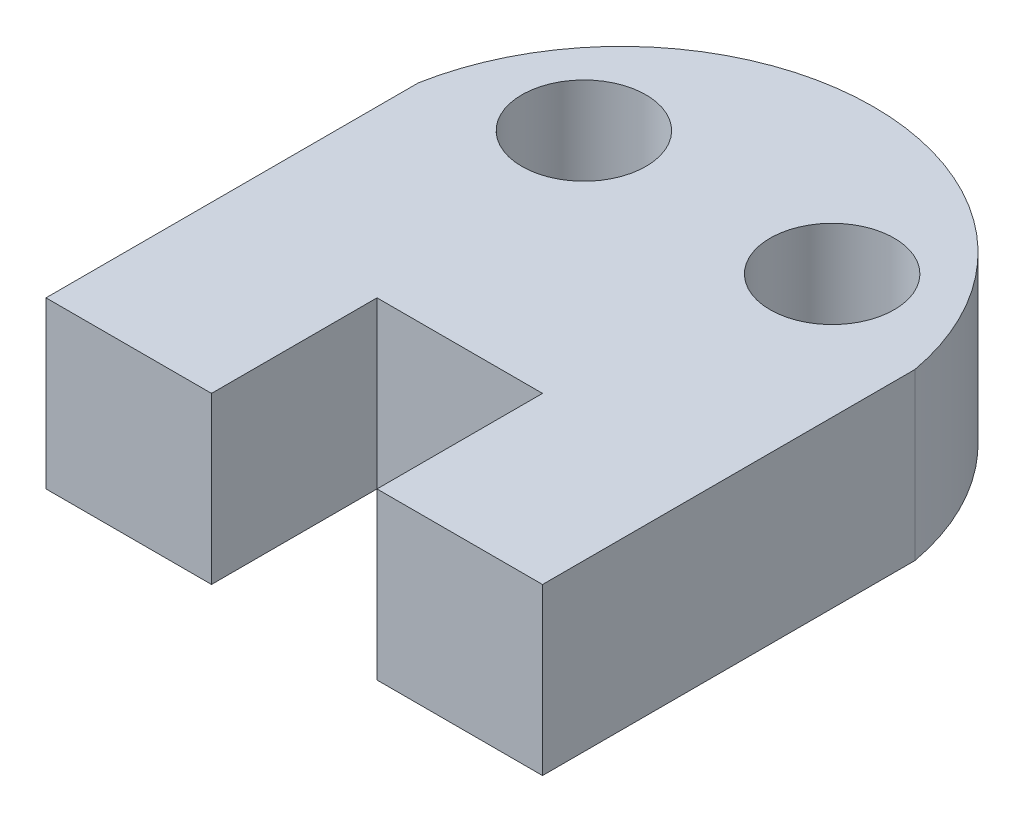
from build123d import *

# Parameters (mm, degrees)
SKETCH1_W           = 12
SKETCH1_H           = 10
SKETCH1_W_2         = 4
SKETCH1_H_2         = 4
BOSS_EXTRUDE1_DEPTH = 4
SKETCH2_R           = 1.5
CUT_EXTRUDE1_DEPTH  = 12.532562595
CUT_EXTRUDE3_DEPTH  = 4


with BuildPart() as part:
    # Sketch1 → Boss-Extrude1 (new body)
    with BuildSketch(Plane(origin=(0, 0, 0), x_dir=(1, 0, 0), z_dir=(0, 1, 0))):
        Rectangle(SKETCH1_W, SKETCH1_H)
        with Locations((-4, -7)):
            Rectangle(SKETCH1_W_2, SKETCH1_H_2)
        with Locations((4, -7)):
            Rectangle(SKETCH1_W_2, SKETCH1_H_2)
    extrude(amount=BOSS_EXTRUDE1_DEPTH)

    # Sketch2 → Cut-Extrude1 (cut, through all)
    with BuildSketch(Plane(origin=(0, 4, 0), x_dir=(1, 0, 0), z_dir=(0, 1, 0))):
        with Locations(Location((-3, 1, 0), (0, 0, 270))):
            Circle(SKETCH2_R)
        with Locations(Location((3, 1, 0), (0, 0, 270))):
            Circle(SKETCH2_R)
    extrude(amount=-CUT_EXTRUDE1_DEPTH, mode=Mode.SUBTRACT)

    # Sketch3 → Cut-Extrude3 (cut)
    with BuildSketch(Plane(origin=(0, 4, 0), x_dir=(1, 0, 0), z_dir=(0, 1, 0))):
        with BuildLine():
            ThreePointArc((-6, 0), (-3.905124845, 3.586149799), (-1.9e-08, 5))
            Line((-1.9e-08, 5), (-6, 5))
            Line((-6, 5), (-6, 0))
        make_face()
        with BuildLine():
            ThreePointArc((-1.9e-08, 5), (3.905124831, 3.586149812), (6, 0))
            Line((6, 0), (6, 5))
            Line((6, 5), (-1.9e-08, 5))
        make_face()
    extrude(amount=-CUT_EXTRUDE3_DEPTH, mode=Mode.SUBTRACT)


solid = part.part
